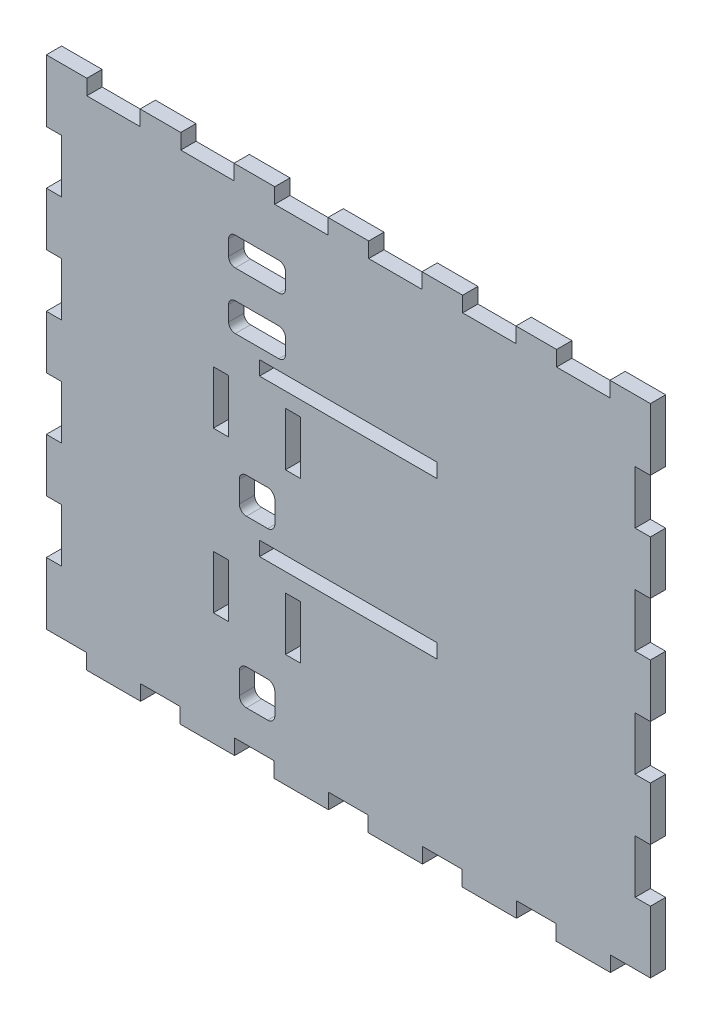
from build123d import *

# Parameters (mm, degrees)
SKETCH1_W           = 4.3
SKETCH1_H           = 15
SKETCH1_W_2         = 50
SKETCH1_H_2         = 4
BOSS_EXTRUDE1_DEPTH = 4.3


with BuildPart() as part:
    # Sketch1 → Boss-Extrude1 (new body)
    with BuildSketch(Plane.XY):
        Polygon((0, 140), (11.393, 140), (11.393, 135.7), (26.393, 135.7), (26.393, 140), (37.836, 140), (37.836, 135.7), (52.836, 135.7), (52.836, 140), (64.279, 140), (64.279, 135.7), (79.279, 135.7), (79.279, 140), (90.722, 140), (90.722, 135.7), (105.722, 135.7), (105.722, 140), (117.165, 140), (117.165, 135.7), (132.165, 135.7), (132.165, 140), (143.608, 140), (143.608, 135.7), (158.608, 135.7), (158.608, 140), (170, 140), (170, 122.5), (165.7, 122.5), (165.7, 107.5), (170, 107.5), (170, 92.5), (165.7, 92.5), (165.7, 77.5), (170, 77.5), (170, 62.5), (165.7, 62.5), (165.7, 47.5), (170, 47.5), (170, 32.5), (165.7, 32.5), (165.7, 17.5), (170, 17.5), (170, 0), (158.758, 0), (158.758, -4.3), (143.458, -4.3), (143.458, 0), (132.315, 0), (132.315, -4.3), (117.015, -4.3), (117.015, 0), (105.872, 0), (105.872, -4.3), (90.572, -4.3), (90.572, 0), (79.429, 0), (79.429, -4.3), (64.129, -4.3), (64.129, 0), (52.986, 0), (52.986, -4.3), (37.686, -4.3), (37.686, 0), (26.543, 0), (26.543, -4.3), (11.243, -4.3), (11.243, 0), (0, 0), (0, 17.5), (4.3, 17.5), (4.3, 32.5), (0, 32.5), (0, 47.5), (4.3, 47.5), (4.3, 62.5), (0, 62.5), (0, 77.5), (4.3, 77.5), (4.3, 92.5), (0, 92.5), (0, 107.5), (4.3, 107.5), (4.3, 122.5), (0, 122.5), align=None)
        with Locations((69.45, 35)):
            Rectangle(SKETCH1_W, SKETCH1_H, mode=Mode.SUBTRACT)
        with Locations((69.45, 80)):
            Rectangle(SKETCH1_W, SKETCH1_H, mode=Mode.SUBTRACT)
        with Locations((49.15, 80)):
            Rectangle(SKETCH1_W, SKETCH1_H, mode=Mode.SUBTRACT)
        with Locations((85, 49.7)):
            Rectangle(SKETCH1_W_2, SKETCH1_H_2, mode=Mode.SUBTRACT)
        with Locations((85, 93.7)):
            Rectangle(SKETCH1_W_2, SKETCH1_H_2, mode=Mode.SUBTRACT)
        with BuildLine():
            Line((53.173708042, 114.65), (65.426291958, 114.65))
            ThreePointArc((65.426291958, 114.65), (66.75120362, 115.19879638), (67.3, 116.523708042))
            Line((67.3, 116.523708042), (67.3, 120.776291958))
            ThreePointArc((67.3, 120.776291958), (66.75120362, 122.10120362), (65.426291958, 122.65))
            Line((65.426291958, 122.65), (53.173708042, 122.65))
            ThreePointArc((53.173708042, 122.65), (51.84879638, 122.10120362), (51.3, 120.776291958))
            Line((51.3, 120.776291958), (51.3, 116.523708042))
            ThreePointArc((51.3, 116.523708042), (51.84879638, 115.19879638), (53.173708042, 114.65))
        make_face(mode=Mode.SUBTRACT)
        with BuildLine():
            Line((53.173708042, 98.65), (65.426291958, 98.65))
            ThreePointArc((65.426291958, 98.65), (66.75120362, 99.19879638), (67.3, 100.523708042))
            Line((67.3, 100.523708042), (67.3, 104.776291958))
            ThreePointArc((67.3, 104.776291958), (66.75120362, 106.10120362), (65.426291958, 106.65))
            Line((65.426291958, 106.65), (53.173708042, 106.65))
            ThreePointArc((53.173708042, 106.65), (51.84879638, 106.10120362), (51.3, 104.776291958))
            Line((51.3, 104.776291958), (51.3, 100.523708042))
            ThreePointArc((51.3, 100.523708042), (51.84879638, 99.19879638), (53.173708042, 98.65))
        make_face(mode=Mode.SUBTRACT)
        with Locations((49.15, 35)):
            Rectangle(SKETCH1_W, SKETCH1_H, mode=Mode.SUBTRACT)
        with BuildLine():
            Line((56.3, 9), (62.3, 9))
            ThreePointArc((62.3, 9), (63.714213562, 9.585786438), (64.3, 11))
            Line((64.3, 11), (64.3, 17))
            ThreePointArc((64.3, 17), (63.714213562, 18.414213562), (62.3, 19))
            Line((62.3, 19), (56.3, 19))
            ThreePointArc((56.3, 19), (54.885786438, 18.414213562), (54.3, 17))
            Line((54.3, 17), (54.3, 11))
            ThreePointArc((54.3, 11), (54.885786438, 9.585786438), (56.3, 9))
        make_face(mode=Mode.SUBTRACT)
        with BuildLine():
            Line((56.3, 65.7), (62.3, 65.7))
            ThreePointArc((62.3, 65.7), (63.714213562, 65.114213562), (64.3, 63.7))
            Line((64.3, 63.7), (64.3, 57.7))
            ThreePointArc((64.3, 57.7), (63.714213562, 56.285786438), (62.3, 55.7))
            Line((62.3, 55.7), (56.3, 55.7))
            ThreePointArc((56.3, 55.7), (54.885786438, 56.285786438), (54.3, 57.7))
            Line((54.3, 57.7), (54.3, 63.7))
            ThreePointArc((54.3, 63.7), (54.885786438, 65.114213562), (56.3, 65.7))
        make_face(mode=Mode.SUBTRACT)
    extrude(amount=BOSS_EXTRUDE1_DEPTH)


solid = part.part
